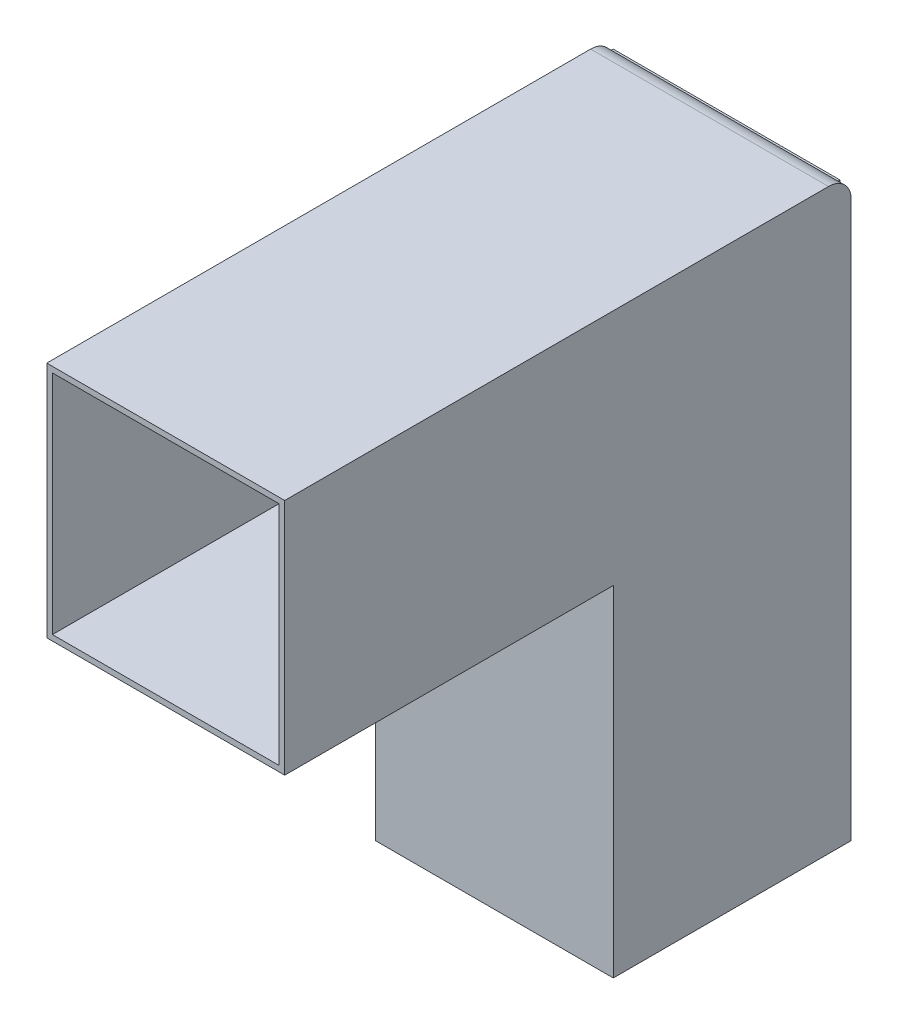
from build123d import *

# Parameters (mm, degrees)
ESQUISSE1_W        = 21
ESQUISSE1_H        = 21
BOSS_EXTRU_1_DEPTH = 50
ESQUISSE3_W        = 21
ESQUISSE3_H        = 21
BOSS_EXTRU_2_DEPTH = 30
COQUE1_T           = -0.5
CONG_1_R           = 2


with BuildPart() as part:
    # Esquisse1 → Boss.-Extru.1 (new body)
    with BuildSketch(Plane.XY):
        Rectangle(ESQUISSE1_W, ESQUISSE1_H)
    extrude(amount=BOSS_EXTRU_1_DEPTH)

    # Esquisse3 → Boss.-Extru.2 (add)
    with BuildSketch(Plane.XZ.offset(10.5)):
        with Locations((0, 10.5)):
            Rectangle(ESQUISSE3_W, ESQUISSE3_H)
    extrude(amount=BOSS_EXTRU_2_DEPTH)

    # Coque1
    coque1_openings = [part.faces().sort_by_distance(p)[0] for p in [
        (0, 0, 50),
        (0, -40.5, 10.5),
    ]]
    offset(amount=COQUE1_T, openings=coque1_openings, kind=Kind.INTERSECTION)

    # Congé1
    cong_1_edges = [part.edges().sort_by_distance(p)[0] for p in [
        (0, 10.5, 0),
    ]]
    fillet(cong_1_edges, radius=CONG_1_R)


solid = part.part
